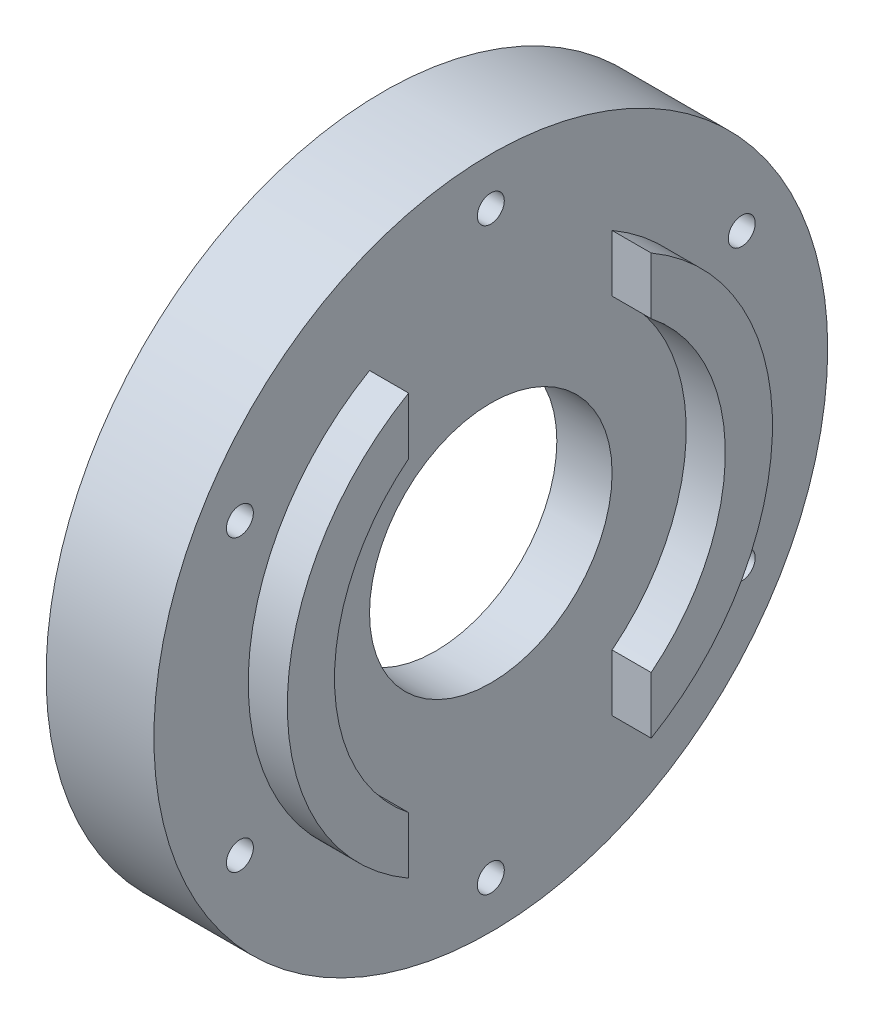
from build123d import *

# Parameters (mm, degrees)
SKETCH1_R                 = 125
SKETCH1_R_2               = 45
SKETCH1_R_3               = 5
BOSS_EXTRUDE1_DEPTH       = 40
SKETCH3_R                 = 90
SKETCH3_R_2               = 72.5
BOSS_EXTRUDE2_DEPTH       = 14.5
CUT_EXTRUDE1_DEPTH        = 182.245689604
CUT_EXTRUDE1_DEPTH_BACK   = 182.245689604
SKETCH4_W                 = 14.5
SKETCH4_H                 = 90
SKETCH5_R                 = 100
CUT_EXTRUDE3_DEPTH        = 19.5
F_8_0MM_DOWEL_HOLE1_D     = 8
F_8_0MM_DOWEL_HOLE1_DEPTH = 10
F_8_0MM_DOWEL_HOLE1_TIP   = 2.403442476


with BuildPart() as part:
    # Sketch1 → Boss-Extrude1 (new body)
    with BuildSketch(Plane(origin=(0, 0, 0), x_dir=(0, 0, -1), z_dir=(1, 0, 0))):
        Circle(SKETCH1_R)
        Circle(SKETCH1_R_2, mode=Mode.SUBTRACT)
        with Locations((0, 107.5)):
            Circle(SKETCH1_R_3, mode=Mode.SUBTRACT)
        with Locations(Location((93.097730907, 53.75, 0), (0, 0, 180))):
            Circle(SKETCH1_R_3, mode=Mode.SUBTRACT)
        with Locations(Location((-93.097730907, 53.75, 0), (0, 0, 180))):
            Circle(SKETCH1_R_3, mode=Mode.SUBTRACT)
        with Locations((-93.097730907, -53.75)):
            Circle(SKETCH1_R_3, mode=Mode.SUBTRACT)
        with Locations(Location((0, -107.5, 0), (0, 0, 180))):
            Circle(SKETCH1_R_3, mode=Mode.SUBTRACT)
        with Locations((93.097730907, -53.75)):
            Circle(SKETCH1_R_3, mode=Mode.SUBTRACT)
    extrude(amount=-BOSS_EXTRUDE1_DEPTH)

    # Sketch3 → Boss-Extrude2 (add)
    with BuildSketch(Plane(origin=(0, 0, 0), x_dir=(0, 0, -1), z_dir=(1, 0, 0))):
        with Locations(Location((0, 0, 0), (0, 0, 180))):
            Circle(SKETCH3_R)
        with Locations(Location((0, 0, 0), (0, 0, 180))):
            Circle(SKETCH3_R_2, mode=Mode.SUBTRACT)
    extrude(amount=BOSS_EXTRUDE2_DEPTH)

    # Sketch4 → Cut-Extrude1 (cut, two sides: drawn at the far end of the back side and taken through both)
    with BuildSketch(Plane(origin=(0, 0, 0), x_dir=(1, 0, 0), z_dir=(0, 1, 0)).offset(-CUT_EXTRUDE1_DEPTH_BACK)):
        with Locations((7.25, 0)):
            Rectangle(SKETCH4_W, SKETCH4_H)
    extrude(amount=CUT_EXTRUDE1_DEPTH + CUT_EXTRUDE1_DEPTH_BACK, mode=Mode.SUBTRACT)

    # Sketch5 → Cut-Extrude3 (cut)
    with BuildSketch(Plane.ZY.offset(40)):
        Circle(SKETCH5_R)
    extrude(amount=-CUT_EXTRUDE3_DEPTH, mode=Mode.SUBTRACT)

    # Ø8.0mm Dowel Hole1
    with Locations(Plane.ZY.offset(20.5)):
        with Locations((0, 90), (77.942286341, 45), (77.942286341, -45), (0, -90), (-77.942286341, -45), (-77.942286341, 45)):
            Hole(F_8_0MM_DOWEL_HOLE1_D / 2, depth=F_8_0MM_DOWEL_HOLE1_DEPTH)
            with Locations((0, 0, -(F_8_0MM_DOWEL_HOLE1_DEPTH + F_8_0MM_DOWEL_HOLE1_TIP / 2))):  # 118° drill point
                Cone(0, F_8_0MM_DOWEL_HOLE1_D / 2, F_8_0MM_DOWEL_HOLE1_TIP, mode=Mode.SUBTRACT)


solid = part.part
